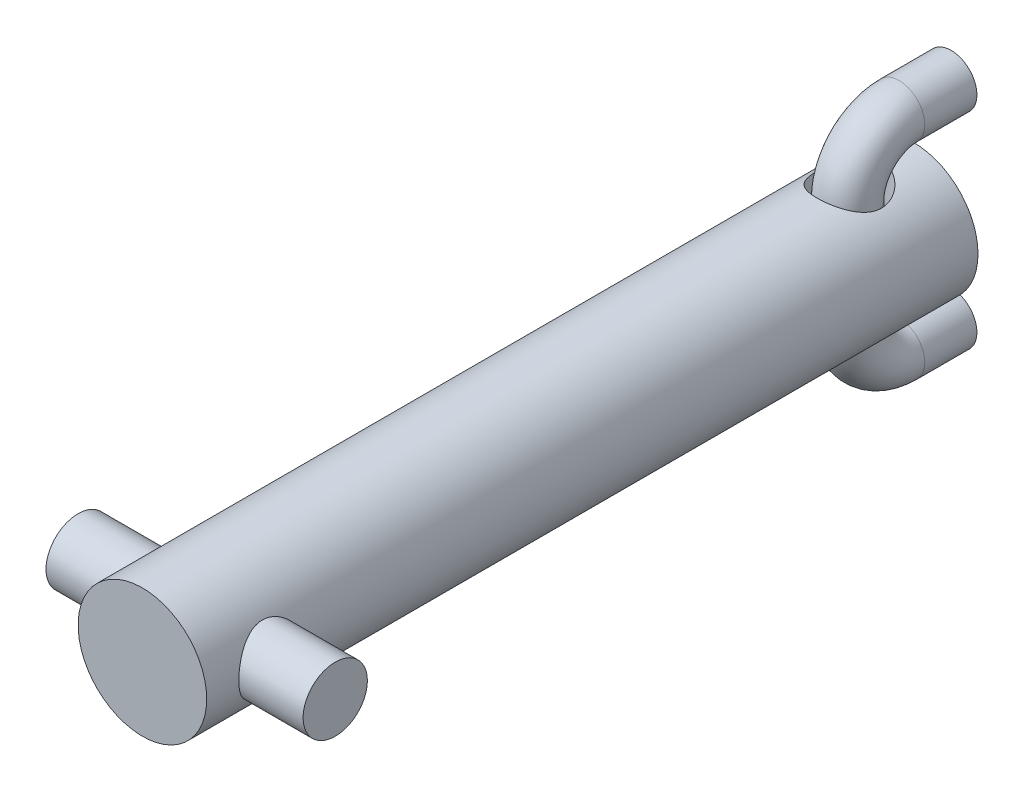
from build123d import *

# Parameters (mm, degrees)
SKETCH1_R           = 3.175
BOSS_EXTRUDE1_DEPTH = 38.1
SKETCH2_R           = 1.5875
CUT_EXTRUDE1_DEPTH  = 15.875
SKETCH3_R           = 1.5875
BOSS_EXTRUDE2_DEPTH = 6.35
SWEEP1_PROFILE_R    = 1.27


with BuildPart() as part:
    # Sketch1 → Boss-Extrude1 (new body)
    with BuildSketch(Plane.XY):
        with Locations(Location((0, 0, 0), (0, 0, 180))):
            Circle(SKETCH1_R)
    extrude(amount=BOSS_EXTRUDE1_DEPTH)

    # Sketch2 → Cut-Extrude1 (cut, symmetric)
    with BuildSketch(Plane(origin=(0, 0, 0), x_dir=(1, 0, 0), z_dir=(0, 1, 0))):
        with Locations(Location((0, -3.175, 0), (0, 0, 270))):
            Circle(SKETCH2_R)
    extrude(amount=CUT_EXTRUDE1_DEPTH, both=True, mode=Mode.SUBTRACT)

    # Sketch3 → Boss-Extrude2 (add, symmetric)
    with BuildSketch(Plane(origin=(0, 0, 0), x_dir=(0, 0, -1), z_dir=(1, 0, 0))):
        with Locations((-34.925, 0)):
            Circle(SKETCH3_R)
    extrude(amount=BOSS_EXTRUDE2_DEPTH, both=True)


with BuildPart() as body_2:
    # Sweep1: sweep along a path in Sketch4
    with BuildLine(Plane(origin=(0, 0, 0), x_dir=(0, 0, -1), z_dir=(1, 0, 0))) as sweep1_path:
        Line((1.85035109, 4.922501093), (-0.723036469, 4.922501093))
        ThreePointArc((-0.723036469, 4.922501093), (-2.519087693, 4.178552317), (-3.263036469, 2.382501093))
        Line((-3.263036469, 2.382501093), (-3.263036469, -2.697498907))
        ThreePointArc((-3.263036469, -2.697498907), (-2.519087693, -4.493550132), (-0.723036469, -5.237498907))
        Line((-0.723036469, -5.237498907), (1.85035109, -5.237498907))
    # Sweep1 profile (on start of the path) → Sweep1 (sweep)
    with BuildSketch(Plane(origin=(0, 4.922501093, -1.85035109), x_dir=(1, 0, 0), z_dir=(0, 0, 1))):
        Circle(SWEEP1_PROFILE_R)
    sweep(path=sweep1_path.line)


solid = Compound([part.part, body_2.part])
